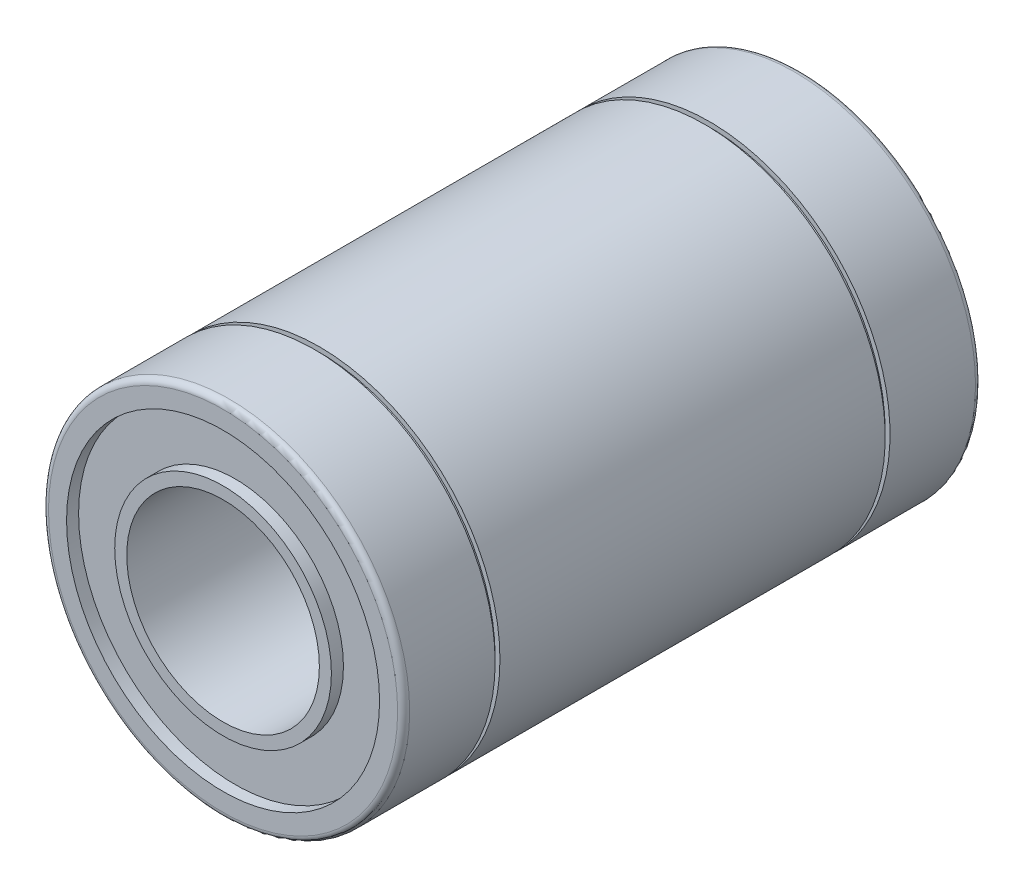
from build123d import *

# Parameters (mm, degrees)
ESBO_O1_R                = 7.5
ESBO_O1_R_2              = 4
RESSALTO_EXTRUS_O1_DEPTH = 12
ESBO_O2_R                = 6.5
ESBO_O2_R_2              = 4.5
CORTE_EXTRUS_O1_DEPTH    = 0.5
CORTE_EXTRUS_O2_START    = -0.5
ESBO_O3_R                = 6.5
ESBO_O3_R_2              = 4.5
CORTE_EXTRUS_O2_DEPTH    = 0.5
ESBO_O4_R                = 8.150175923
ESBO_O4_R_2              = 7.3
CORTE_EXTRUS_O3_DEPTH    = 0.2
FILETE1_R                = 0.25


with BuildPart() as part:
    # Esboço1 → Ressalto-extrusão1 (new, symmetric)
    with BuildSketch(Plane.XY):
        Circle(ESBO_O1_R)
        Circle(ESBO_O1_R_2, mode=Mode.SUBTRACT)
    extrude(amount=RESSALTO_EXTRUS_O1_DEPTH, both=True)

    # Esboço2 → Corte-extrusão1 (cut)
    with BuildSketch(Plane.XY.offset(12)):
        Circle(ESBO_O2_R)
        Circle(ESBO_O2_R_2, mode=Mode.SUBTRACT)
    extrude(amount=-CORTE_EXTRUS_O1_DEPTH, mode=Mode.SUBTRACT)

    # Esboço3 → Corte-extrusão2 (cut)
    with BuildSketch(Plane(origin=(0, 0, -12), x_dir=(-1, 0, 0), z_dir=(0, 0, -1)).offset(CORTE_EXTRUS_O2_START)):
        with Locations(Location((0, 0, 0), (0, 0, 180))):
            Circle(ESBO_O3_R)
        with Locations(Location((0, 0, 0), (0, 0, 180))):
            Circle(ESBO_O3_R_2, mode=Mode.SUBTRACT)
    extrude(amount=CORTE_EXTRUS_O2_DEPTH, mode=Mode.SUBTRACT)

    # Esboço4 → Corte-extrusão3 (cut)
    with BuildSketch(Plane.XY.offset(8)):
        Circle(ESBO_O4_R)
        Circle(ESBO_O4_R_2, mode=Mode.SUBTRACT)
    corte_extrus_o3 = extrude(amount=CORTE_EXTRUS_O3_DEPTH, mode=Mode.SUBTRACT)

    # Espelhar1: Corte-extrusão3 across plane
    add(corte_extrus_o3.mirror(Plane.XY), mode=Mode.SUBTRACT)

    # Filete1
    filete1_edges = [part.edges().sort_by_distance(p)[0] for p in [
        (-7.5, 0, -12),
        (-7.5, 0, 12),
    ]]
    fillet(filete1_edges, radius=FILETE1_R)


solid = part.part
